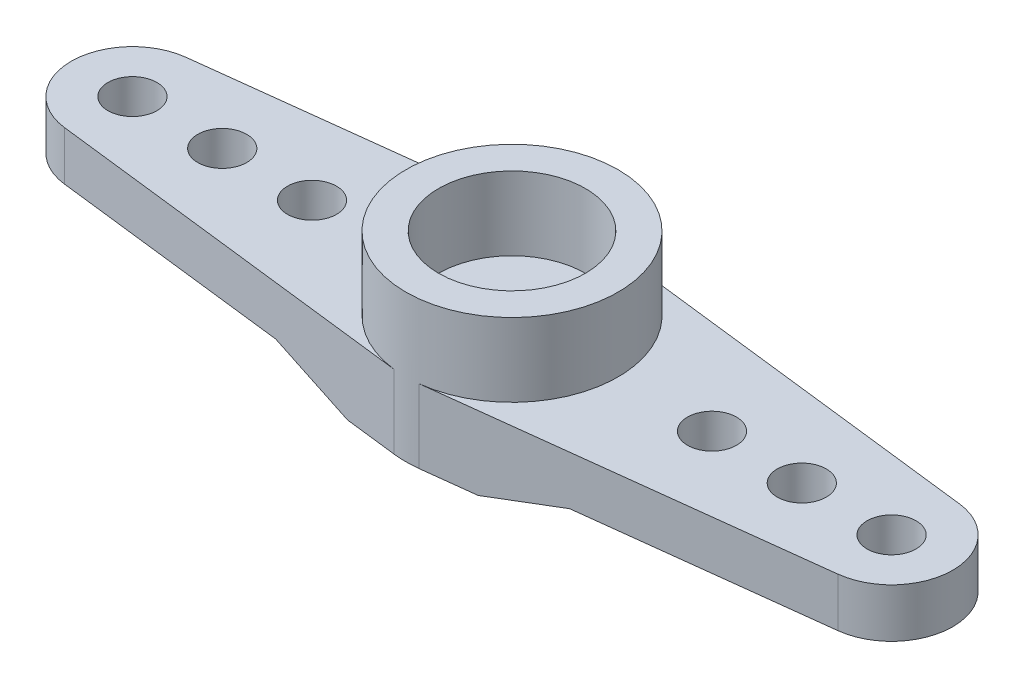
from build123d import *
from build123d.topology import SkipClean

# Parameters (mm, degrees)
SALIENTE_EXTRUIR1_DEPTH             = 3
CROQUIS2_R                          = 6.5
CROQUIS2_R_2                        = 4.5
SALIENTE_EXTRUIR2_DEPTH             = 4.5
SALIENTE_EXTRUIR3_START             = 1.5
SALIENTE_EXTRUIR3_DEPTH             = 1.5
SALIENTE_EXTRUIR4_REACH             = 30.766
SALIENTE_EXTRUIR4_DIRECTION_2_REACH = 30.766
SALIENTE_EXTRUIR5_REACH             = 30.766
SALIENTE_EXTRUIR5_DIRECTION_2_REACH = 30.766
CROQUIS7_R                          = 3.5
CORTAR_EXTRUIR1_DEPTH               = 2.5
CORTAR_EXTRUIR2_DEPTH               = 29.521921394
CORTAR_EXTRUIR2_DEPTH_BACK          = 29.521921394
CROQUIS8_R                          = 1.5


with BuildPart() as part:
    # Croquis1 → Saliente-Extruir1 (new body)
    with BuildSketch(Plane(origin=(0, 0, 0), x_dir=(1, 0, 0), z_dir=(0, 1, 0))):
        with BuildLine():
            Line((0.768817204, 6.45437217), (23.693548387, 3.723676252))
            ThreePointArc((23.693548387, 3.723676252), (27, 0), (23.693548387, -3.723676252))
            Line((23.693548387, -3.723676252), (0.768817204, -6.45437217))
            ThreePointArc((0.768817204, -6.45437217), (0, -6.5), (-0.768817204, -6.45437217))
            Line((-0.768817204, -6.45437217), (-23.693548387, -3.723676252))
            ThreePointArc((-23.693548387, -3.723676252), (-27, 0), (-23.693548387, 3.723676252))
            Line((-23.693548387, 3.723676252), (-0.768817204, 6.45437217))
            ThreePointArc((-0.768817204, 6.45437217), (0, 6.5), (0.768817204, 6.45437217))
        make_face()
    extrude(amount=SALIENTE_EXTRUIR1_DEPTH)

    # Croquis2 → Saliente-Extruir2 (add)
    with BuildSketch(Plane(origin=(0, 3, 0), x_dir=(1, 0, 0), z_dir=(0, 1, 0))):
        with Locations(Location((0, 0, 0), (0, 0, 83.207177944))):
            Circle(CROQUIS2_R)
        with Locations(Location((0, 0, 0), (0, 0, 270))):
            Circle(CROQUIS2_R_2, mode=Mode.SUBTRACT)
    extrude(amount=SALIENTE_EXTRUIR2_DEPTH)

    # Croquis3 → Saliente-Extruir3 (add)
    with SkipClean():  # the faces are left unmerged after this step: merging them gives an invalid solid
        with BuildSketch(Plane.XZ.offset(SALIENTE_EXTRUIR3_START)):
            with BuildLine():
                Line((4, -6.069487497), (0.768817204, -6.45437217))
                ThreePointArc((0.768817204, -6.45437217), (0, -6.5), (-0.768817204, -6.45437217))
                Line((-0.768817204, -6.45437217), (-4, -6.069487497))
                Line((-4, -6.069487497), (-4, 6.069487497))
                Line((-4, 6.069487497), (-0.768817204, 6.45437217))
                ThreePointArc((-0.768817204, 6.45437217), (0, 6.5), (0.768817204, 6.45437217))
                Line((0.768817204, 6.45437217), (4, 6.069487497))
                Line((4, 6.069487497), (4, -6.069487497))
            make_face()
        extrude(amount=-SALIENTE_EXTRUIR3_DEPTH)

    # Saliente-Extruir4: up to this plane
    with SkipClean():  # the faces are left unmerged after this step: merging them gives an invalid solid
        saliente_extruir4_end = Plane(origin=(-0.768817204, 3, 6.45437217), z_dir=(0.11827956989247339, 0, -0.992980333816361))
        # Croquis4 → Saliente-Extruir4 (add, up to the surface)
        with BuildSketch(Plane.XY, mode=Mode.PRIVATE) as saliente_extruir4_sk1:
            Polygon((-4, -1.5), (-4, 0), (-9, 0), align=None)
        saliente_extruir4_tool1 = split(extrude(saliente_extruir4_sk1.sketch, amount=SALIENTE_EXTRUIR4_REACH, mode=Mode.PRIVATE), bisect_by=saliente_extruir4_end, keep=Keep.BOTH, mode=Mode.PRIVATE)
        add(saliente_extruir4_tool1.solids().sort_by_distance((-5.666667, -0.5, 0))[0])

    # Saliente-Extruir4 direction 2: up to this plane
    with SkipClean():  # the faces are left unmerged after this step: merging them gives an invalid solid
        saliente_extruir4_direction_2_end = Plane(origin=(-0.768817204, 3, -6.45437217), z_dir=(0.11827956989247339, 0, 0.992980333816361))
        # Croquis4 → Saliente-Extruir4 direction 2 (add, up to the surface)
        with BuildSketch(Plane.XY, mode=Mode.PRIVATE) as saliente_extruir4_direction_2_sk1:
            Polygon((-4, -1.5), (-4, 0), (-9, 0), align=None)
        saliente_extruir4_direction_2_tool1 = split(extrude(saliente_extruir4_direction_2_sk1.sketch, amount=-SALIENTE_EXTRUIR4_DIRECTION_2_REACH, mode=Mode.PRIVATE), bisect_by=saliente_extruir4_direction_2_end, keep=Keep.BOTH, mode=Mode.PRIVATE)
        add(saliente_extruir4_direction_2_tool1.solids().sort_by_distance((-5.666667, -0.5, 0))[0])

    # Saliente-Extruir5: up to this plane
    with SkipClean():  # the faces are left unmerged after this step: merging them gives an invalid solid
        saliente_extruir5_end = Plane(origin=(0.768817204, 3, 6.45437217), z_dir=(-0.11827956989247339, 0, -0.992980333816361))
        # Croquis5 → Saliente-Extruir5 (add, up to the surface)
        with BuildSketch(Plane.XY, mode=Mode.PRIVATE) as saliente_extruir5_sk1:
            Polygon((4, 0), (9, 0), (4, -1.5), align=None)
        saliente_extruir5_tool1 = split(extrude(saliente_extruir5_sk1.sketch, amount=SALIENTE_EXTRUIR5_REACH, mode=Mode.PRIVATE), bisect_by=saliente_extruir5_end, keep=Keep.BOTH, mode=Mode.PRIVATE)
        add(saliente_extruir5_tool1.solids().sort_by_distance((5.666667, -0.5, 0))[0])

    # Saliente-Extruir5 direction 2: up to this plane
    with SkipClean():  # the faces are left unmerged after this step: merging them gives an invalid solid
        saliente_extruir5_direction_2_end = Plane(origin=(0.768817204, 3, -6.45437217), z_dir=(-0.11827956989247339, 0, 0.992980333816361))
        # Croquis5 → Saliente-Extruir5 direction 2 (add, up to the surface)
        with BuildSketch(Plane.XY, mode=Mode.PRIVATE) as saliente_extruir5_direction_2_sk1:
            Polygon((4, 0), (9, 0), (4, -1.5), align=None)
        saliente_extruir5_direction_2_tool1 = split(extrude(saliente_extruir5_direction_2_sk1.sketch, amount=-SALIENTE_EXTRUIR5_DIRECTION_2_REACH, mode=Mode.PRIVATE), bisect_by=saliente_extruir5_direction_2_end, keep=Keep.BOTH, mode=Mode.PRIVATE)
        add(saliente_extruir5_direction_2_tool1.solids().sort_by_distance((5.666667, -0.5, 0))[0])

    # Croquis7 → Cortar-Extruir1 (cut)
    with SkipClean():  # the faces are left unmerged after this step: merging them gives an invalid solid
        with BuildSketch(Plane.XZ.offset(1.5)):
            with Locations(Location((0, 0, 0), (0, 0, 270))):
                Circle(CROQUIS7_R)
        extrude(amount=-CORTAR_EXTRUIR1_DEPTH, mode=Mode.SUBTRACT)

    # Croquis8 → Cortar-Extruir2 (cut, two sides: drawn at the far end of the back side and taken through both)
    with SkipClean():  # the faces are left unmerged after this step: merging them gives an invalid solid
        with BuildSketch(Plane.XZ.offset(-1).offset(-CORTAR_EXTRUIR2_DEPTH_BACK)):
            with Locations(Location((0, 0, 0), (0, 0, 270))):
                Circle(CROQUIS8_R)
            with Locations(Location((12.25, 0, 0), (0, 0, 270))):
                Circle(CROQUIS8_R)
            with Locations(Location((17.75, 0, 0), (0, 0, 270))):
                Circle(CROQUIS8_R)
            with Locations(Location((23.25, 0, 0), (0, 0, 270))):
                Circle(CROQUIS8_R)
            with Locations(Location((-23.25, 0, 0), (0, 0, 270))):
                Circle(CROQUIS8_R)
            with Locations(Location((-17.75, 0, 0), (0, 0, 270))):
                Circle(CROQUIS8_R)
            with Locations(Location((-12.25, 0, 0), (0, 0, 270))):
                Circle(CROQUIS8_R)
        extrude(amount=CORTAR_EXTRUIR2_DEPTH + CORTAR_EXTRUIR2_DEPTH_BACK, mode=Mode.SUBTRACT)


solid = part.part
